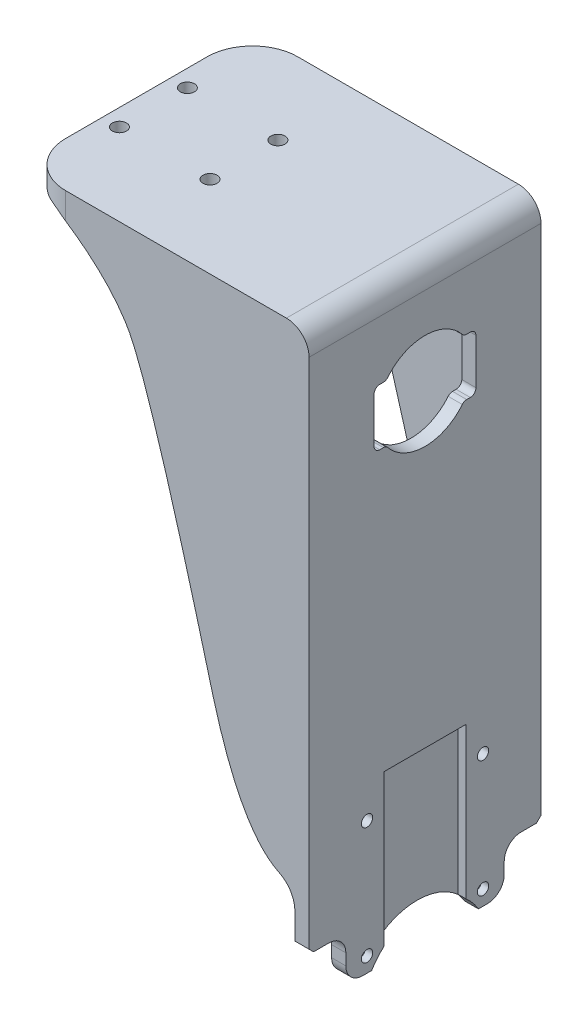
from build123d import *

# Parameters (mm, degrees)
SKETCH_1_W          = 51
SKETCH_1_H          = 41
SKETCH_1_R          = 1.25
EXTRUDE_1_DEPTH     = 3.4
SKETCH_2_R          = 1
EXTRUDE_2_DEPTH     = 2.5
SKETCH_3_W          = 14.5
SKETCH_3_H          = 35.737354226
CUT_EXTRUDE_1_DEPTH = 1.4
EXTRUDE_4_DEPTH     = 2
FILLET_1_R          = 8
FILLET_2_R          = 4
SKETCH_6_R          = 2
CUT_EXTRUDE_2_DEPTH = 1.2
CUT_EXTRUDE_3_DEPTH = 4
FILLET_3_R          = 3
SKETCH_9_R          = 2
CUT_EXTRUDE_4_DEPTH = 0.8
SKETCH_10_R         = 2.5
CUT_EXTRUDE_5_DEPTH = 1.4
CHAMFER_1_SIZE      = 0.8
FILLET_4_R          = 4
FILLET_5_R          = 5
CUT_EXTRUDE_6_DEPTH = 10
FILLET_6_R          = 1


with BuildPart() as part:
    # 草图1 → 凸台-拉伸1 (new body)
    with BuildSketch(Plane(origin=(0, 0, 0), x_dir=(1, 0, 0), z_dir=(0, 1, 0))):
        Rectangle(SKETCH_1_W, SKETCH_1_H)
        with Locations(Location((-22.5, 6, 0), (0, 0, 270))):
            Circle(SKETCH_1_R, mode=Mode.SUBTRACT)
        with Locations(Location((-22.5, -6, 0), (0, 0, 90))):
            Circle(SKETCH_1_R, mode=Mode.SUBTRACT)
        with Locations(Location((-6.5, 6, 0), (0, 0, 270))):
            Circle(SKETCH_1_R, mode=Mode.SUBTRACT)
        with Locations(Location((-6.5, -6, 0), (0, 0, 90))):
            Circle(SKETCH_1_R, mode=Mode.SUBTRACT)
    extrude(amount=EXTRUDE_1_DEPTH)

    # 草图2 → 凸台-拉伸2 (add)
    with BuildSketch(Plane(origin=(25.5, 0, 0), x_dir=(0, 0, -1), z_dir=(1, 0, 0))):
        with BuildLine():
            Line((-20.5, 0), (20.5, 0))
            Line((20.5, 0), (20.5, -100))
            Line((20.5, -100), (9.43808773, -100))
            ThreePointArc((9.43808773, -100), (0, -94.65), (-9.43808773, -100))
            Line((-9.43808773, -100), (-20.5, -100))
            Line((-20.5, -100), (-20.5, 0))
        make_face()
        with Locations((-10.25, -97.35)):
            Circle(SKETCH_2_R, mode=Mode.SUBTRACT)
        with Locations(Location((10.25, -97.35, 0), (0, 0, 180))):
            Circle(SKETCH_2_R, mode=Mode.SUBTRACT)
        with Locations((10.25, -76.65)):
            Circle(SKETCH_2_R, mode=Mode.SUBTRACT)
        with Locations(Location((-10.25, -76.65, 0), (0, 0, 180))):
            Circle(SKETCH_2_R, mode=Mode.SUBTRACT)
    extrude(amount=-EXTRUDE_2_DEPTH)

    # 草图3 → 切除-拉伸1 (cut)
    with BuildSketch(Plane(origin=(25.5, 0, 0), x_dir=(0, 0, -1), z_dir=(1, 0, 0))):
        with Locations((0, -88.518677113)):
            Rectangle(SKETCH_3_W, SKETCH_3_H)
    extrude(amount=-CUT_EXTRUDE_1_DEPTH, mode=Mode.SUBTRACT)

    # 草图5 → 凸台-拉伸4 (add)
    with BuildSketch(Plane(origin=(0, 0, -20.5), x_dir=(-1, 0, 0), z_dir=(0, 0, -1))):
        with BuildLine():
            Line((-25.5, 3.4), (19.5, 3.4))
            Line((19.5, 3.4), (19.5, 0))
            add(Edge.make_bspline(
                [(19.5, 0), (10.67122189, -5.3692624), (2.779429236, -18.193392293), (-14.23746955, -82.475470635), (-23, -82.805044976)],
                knots=[0, 0, 0, 0.396049025, 0.788579615, 1, 1, 1], degree=2))
            Line((-23, -82.805044976), (-25.5, -82.805044976))
            Line((-25.5, -82.805044976), (-25.5, 3.4))
        make_face()
    extrude_4 = extrude(amount=-EXTRUDE_4_DEPTH)

    # 镜向3: 凸台-拉伸4 across plane
    add(extrude_4.mirror(Plane.XY))

    # 圆角1
    fillet_1_edges = [part.edges().sort_by_distance(p)[0] for p in [
        (-25.5, 1.7, -20.5),
        (-25.5, 1.7, 20.5),
    ]]
    fillet(fillet_1_edges, radius=FILLET_1_R)

    # 圆角2
    fillet_2_edges = [part.edges().sort_by_distance(p)[0] for p in [
        (25.5, 3.4, 0),
        (23, 0, 0),
    ]]
    fillet(fillet_2_edges, radius=FILLET_2_R)

    # 草图6 → 切除-拉伸2 (cut)
    with BuildSketch(Plane.ZY.offset(-23)):
        with Locations((10.25, -97.35)):
            Circle(SKETCH_6_R)
        with Locations((-10.25, -97.35)):
            Circle(SKETCH_6_R)
    extrude(amount=-CUT_EXTRUDE_2_DEPTH, mode=Mode.SUBTRACT)

    # 草图8 → 切除-拉伸3 (cut)
    with BuildSketch(Plane(origin=(25.5, 0, 0), x_dir=(0, 0, -1), z_dir=(1, 0, 0))):
        Polygon((14, -102.818047241), (14, -92), (23.468492482, -92), (23.468492482, -110.008191191), (-23.468492482, -110.008191191), (-23.468492482, -92), (-14, -92), (-14, -102.818047241), align=None)
    extrude(amount=-CUT_EXTRUDE_3_DEPTH, mode=Mode.SUBTRACT)

    # 圆角3
    fillet_3_edges = [part.edges().sort_by_distance(p)[0] for p in [
        (24.25, -100, 14),
        (24.25, -100, -14),
        (24.25, -92, -14),
        (24.25, -92, 14),
    ]]
    fillet(fillet_3_edges, radius=FILLET_3_R)

    # 草图9 → 切除-拉伸4 (cut)
    with BuildSketch(Plane.ZY.offset(-23)):
        with Locations((10.25, -76.65)):
            Circle(SKETCH_9_R)
        with Locations(Location((-10.25, -76.65, 0), (0, 0, 180))):
            Circle(SKETCH_9_R)
    extrude(amount=-CUT_EXTRUDE_4_DEPTH, mode=Mode.SUBTRACT)

    # 草图10 → 切除-拉伸5 (cut)
    with BuildSketch(Plane(origin=(0, 0, 0), x_dir=(-1, 0, 0), z_dir=(0, -1, 0))):
        with Locations(Location((6.5, -6, 0), (0, 0, 90))):
            Circle(SKETCH_10_R)
        with Locations(Location((22.5, -6, 0), (0, 0, 270))):
            Circle(SKETCH_10_R)
        with Locations(Location((6.5, 6, 0), (0, 0, 270))):
            Circle(SKETCH_10_R)
        with Locations(Location((22.5, 6, 0), (0, 0, 90))):
            Circle(SKETCH_10_R)
    extrude(amount=-CUT_EXTRUDE_5_DEPTH, mode=Mode.SUBTRACT)

    # 倒角1
    chamfer_1_edges = [part.edges().sort_by_distance(p)[0] for p in [
        (24.25, -92, 20.5),
        (24.25, -92, -20.5),
    ]]
    chamfer(chamfer_1_edges, length=CHAMFER_1_SIZE)

    # 圆角4
    fillet_4_edges = [part.edges().sort_by_distance(p)[0] for p in [
        (-0.25, 0, -18.5),
        (21.828427125, -1.171572875, -18.5),
        (-0.25, 0, 18.5),
        (21.828427125, -1.171572875, 18.5),
        (23, -43.402522488, -18.5),
        (23, -43.402522488, 18.5),
    ]]
    fillet(fillet_4_edges, radius=FILLET_4_R)

    # 圆角5
    fillet_5_edges = [part.edges().sort_by_distance(p)[0] for p in [
        (23, -82.805044976, 16.5),
        (23, -82.805044976, -16.5),
        (-19.5, 0, 16.5),
        (-19.5, 0, -16.5),
    ]]
    fillet(fillet_5_edges, radius=FILLET_5_R)

    # 草图12 → 切除-拉伸6 (cut)
    with BuildSketch(Plane.ZY.offset(-23)):
        with BuildLine():
            Line((-6.873863542, -11), (-9, -11))
            Line((-9, -11), (-9, -21))
            Line((-9, -21), (-6.873863542, -21))
            ThreePointArc((-6.873863542, -21), (0, -24.5), (6.873863542, -21))
            Line((6.873863542, -21), (9, -21))
            Line((9, -21), (9, -11))
            Line((9, -11), (6.873863542, -11))
            ThreePointArc((6.873863542, -11), (0, -7.5), (-6.873863542, -11))
        make_face()
    extrude(amount=-CUT_EXTRUDE_6_DEPTH, mode=Mode.SUBTRACT)

    # 圆角6
    fillet_6_edges = [part.edges().sort_by_distance(p)[0] for p in [
        (24.25, -21, -9),
        (24.25, -11, -9),
        (24.25, -11, -6.873863542),
        (24.25, -11, 6.873863542),
        (24.25, -11, 9),
        (24.25, -21, 9),
        (24.25, -21, 6.873863542),
        (24.25, -21, -6.873863542),
    ]]
    fillet(fillet_6_edges, radius=FILLET_6_R)


solid = part.part
